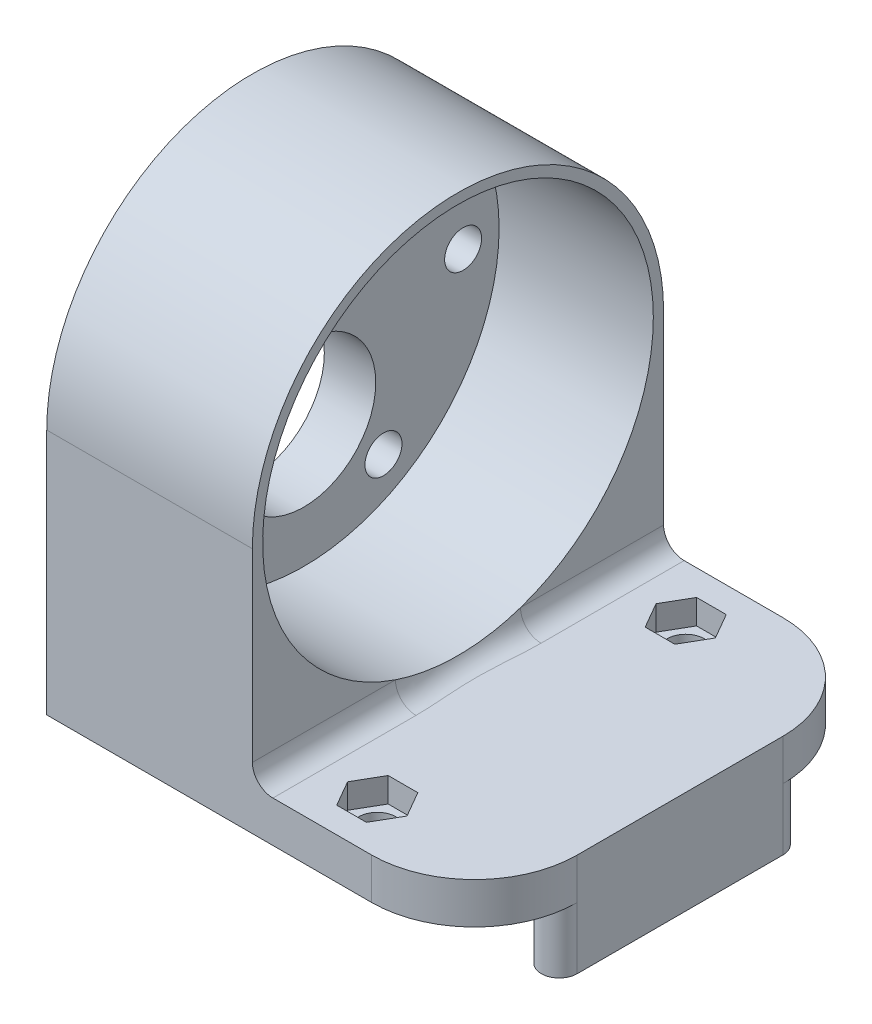
from build123d import *

# Parameters (mm, degrees)
ESQUISSE1_W             = 41.6
ESQUISSE1_H             = 40
BOSS_EXTRU_1_DEPTH      = 4
BOSS_EXTRU_2_DEPTH      = 20
ESQUISSE3_R             = 19
ENL_V_MAT_EXTRU_1_DEPTH = 15
ENL_V_MAT_EXTRU_2_REACH = 62.626
ESQUISSE5_R             = 7
BOSS_EXTRU_3_DEPTH      = 6
D_GAGEMENT_M31_D        = 3.6
CONG_1_R                = 10
D_GAGEMENT_M32_D        = 3.6
ENL_V_MAT_EXTRU_3_DEPTH = 2.4
CONG_2_R                = 2


with BuildPart() as part:
    # Esquisse1 → Boss.-Extru.1 (new body)
    with BuildSketch(Plane(origin=(0, 0, 0), x_dir=(1, 0, 0), z_dir=(0, 1, 0))):
        with Locations((20.8, 0)):
            Rectangle(ESQUISSE1_W, ESQUISSE1_H)
    extrude(amount=BOSS_EXTRU_1_DEPTH)

    # Esquisse2 → Boss.-Extru.2 (add)
    with BuildSketch(Plane.ZY):
        with BuildLine():
            Line((-20, 4), (20, 4))
            Line((20, 4), (20, 24))
            ThreePointArc((20, 24), (0, 44), (-20, 24))
            Line((-20, 24), (-20, 4))
        make_face()
    extrude(amount=-BOSS_EXTRU_2_DEPTH)

    # Esquisse3 → Enlèv. mat.-Extru.1 (cut)
    with BuildSketch(Plane(origin=(20, 0, 0), x_dir=(0, 0, -1), z_dir=(1, 0, 0))):
        with Locations((0, 24)):
            Circle(ESQUISSE3_R)
    extrude(amount=-ENL_V_MAT_EXTRU_1_DEPTH, mode=Mode.SUBTRACT)

    # Esquisse5 → Enlèv. mat.-Extru.2 (cut, up to next)
    with BuildSketch(Plane(origin=(5, 0, 0), x_dir=(0, 0, -1), z_dir=(1, 0, 0)), mode=Mode.PRIVATE) as enl_v_mat_extru_2_sk1:
        with Locations((0, 17)):
            Circle(ESQUISSE5_R)
    enl_v_mat_extru_2_tool1 = extrude(enl_v_mat_extru_2_sk1.sketch, amount=-ENL_V_MAT_EXTRU_2_REACH, mode=Mode.PRIVATE) & part.part
    add(enl_v_mat_extru_2_tool1.solids().sort_by_distance((5, 17, 0))[0], mode=Mode.SUBTRACT)

    # Esquisse6 → Boss.-Extru.3 (add)
    with BuildSketch(Plane.XZ):
        with BuildLine():
            Line((3.5, 10), (3.5, -10))
            ThreePointArc((3.5, -10), (1.75, -11.75), (0, -10))
            Line((0, -10), (0, 10))
            ThreePointArc((0, 10), (1.75, 11.75), (3.5, 10))
        make_face()
        with BuildLine():
            Line((41.6, 10), (41.6, -10))
            ThreePointArc((41.6, -10), (39.85, -11.75), (38.1, -10))
            Line((38.1, -10), (38.1, 10))
            ThreePointArc((38.1, 10), (39.85, 11.75), (41.6, 10))
        make_face()
    extrude(amount=BOSS_EXTRU_3_DEPTH)

    # Dégagement M31 (through all)
    with Locations(Plane(origin=(5, 0, 0), x_dir=(0, 0, -1), z_dir=(1, 0, 0))):
        with Locations((-15.5, 24), (-7.75, 37.423393759), (7.75, 37.423393759), (15.5, 24), (7.75, 10.576606241), (-7.75, 10.576606241)):
            Hole(D_GAGEMENT_M31_D / 2)

    # Congé1
    cong_1_edges = [part.edges().sort_by_distance(p)[0] for p in [
        (41.6, 2, -20),
        (41.6, 2, 20),
    ]]
    fillet(cong_1_edges, radius=CONG_1_R)

    # Dégagement M32 (through all)
    with Locations(Plane(origin=(0, 4, 0), x_dir=(1, 0, 0), z_dir=(0, 1, 0))):
        with Locations((27.15, -15), (27.15, 15)):
            Hole(D_GAGEMENT_M32_D / 2)

    # Esquisse12 → Enlèv. mat.-Extru.3 (cut)
    with BuildSketch(Plane(origin=(0, 4, 0), x_dir=(1, 0, 0), z_dir=(0, 1, 0))):
        Polygon((30.036751346, -15), (28.593375673, -12.5), (25.706624327, -12.5), (24.263248654, -15), (25.706624327, -17.5), (28.593375673, -17.5), align=None)
        Polygon((30.036751346, 15), (28.593375673, 17.5), (25.706624327, 17.5), (24.263248654, 15), (25.706624327, 12.5), (28.593375673, 12.5), align=None)
    extrude(amount=-ENL_V_MAT_EXTRU_3_DEPTH, mode=Mode.SUBTRACT)

    # Congé2
    cong_2_edges = [part.edges().sort_by_distance(p)[0] for p in [
        (20, 4, 0),
    ]]
    fillet(cong_2_edges, radius=CONG_2_R)


solid = part.part
